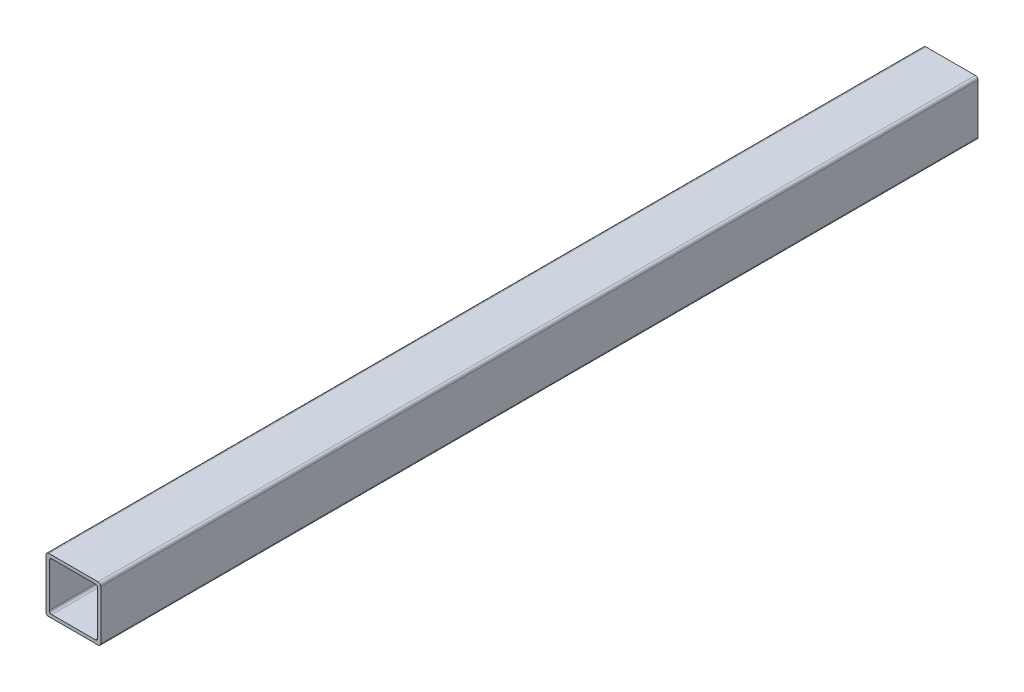
from build123d import *

# Parameters (mm, degrees)
BOSS_EXTRU_1_DEPTH = 812.8


with BuildPart() as part:
    # Esquisse1 → Boss.-Extru.1 (new body)
    with BuildSketch(Plane.XY.offset(406.4)):
        with BuildLine():
            Line((25.4, -22.86), (25.4, 22.86))
            ThreePointArc((25.4, 22.86), (24.656051224, 24.656051224), (22.86, 25.4))
            Line((22.86, 25.4), (-22.86, 25.4))
            ThreePointArc((-22.86, 25.4), (-24.656051224, 24.656051224), (-25.4, 22.86))
            Line((-25.4, 22.86), (-25.4, -22.86))
            ThreePointArc((-25.4, -22.86), (-24.656051224, -24.656051224), (-22.86, -25.4))
            Line((-22.86, -25.4), (22.86, -25.4))
            ThreePointArc((22.86, -25.4), (24.656051224, -24.656051224), (25.4, -22.86))
        make_face()
        with BuildLine():
            Line((-20.1168, 22.352), (20.1168, 22.352))
            ThreePointArc((20.1168, 22.352), (21.697325077, 21.697325077), (22.352, 20.1168))
            Line((22.352, 20.1168), (22.352, -20.1168))
            ThreePointArc((22.352, -20.1168), (21.697325077, -21.697325077), (20.1168, -22.352))
            Line((20.1168, -22.352), (-20.1168, -22.352))
            ThreePointArc((-20.1168, -22.352), (-21.697325077, -21.697325077), (-22.352, -20.1168))
            Line((-22.352, -20.1168), (-22.352, 20.1168))
            ThreePointArc((-22.352, 20.1168), (-21.697325077, 21.697325077), (-20.1168, 22.352))
        make_face(mode=Mode.SUBTRACT)
    extrude(amount=-BOSS_EXTRU_1_DEPTH)


solid = part.part
